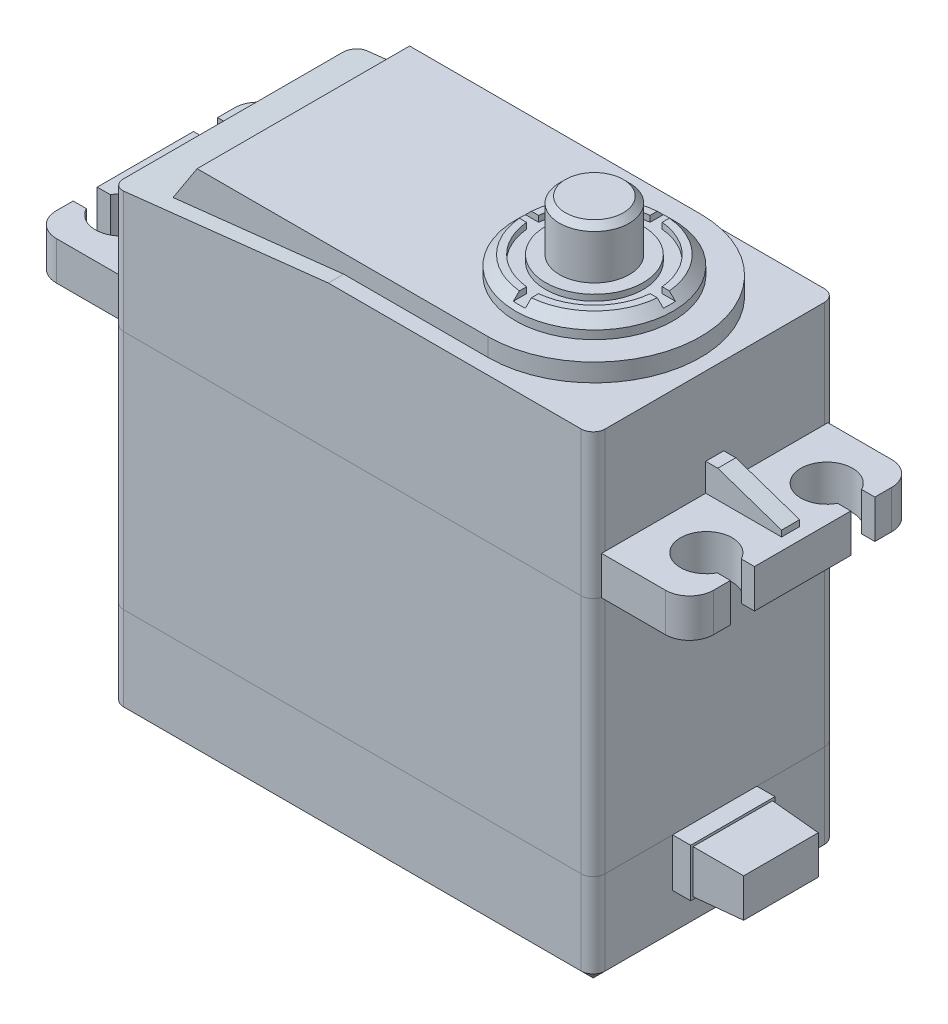
from build123d import *

# Parameters (mm, degrees)
SKETCH1_W                       = 40
SKETCH1_H                       = 20.2
BOSS_EXTRUDE1_DEPTH             = 8
SKETCH3_W                       = 40
SKETCH3_H                       = 20.2
BOSS_EXTRUDE2_DEPTH             = 20
SKETCH4_W                       = 40
SKETCH4_H                       = 20.2
BOSS_EXTRUDE5_DEPTH             = 12
CUT_EXTRUDE1_DEPTH              = 61.066962633
SKETCH6_W                       = 7.3
SKETCH6_H                       = 18.8
BOSS_EXTRUDE6_DEPTH             = 3.2
BOSS_EXTRUDE6_2_DEPTH           = 3.2
CUT_EXTRUDE2_DEPTH              = 61.156213312
BOSS_EXTRUDE7_DEPTH             = 0.75
FILLET1_R                       = 2
FILLET3_R                       = 2
BOSS_EXTRUDE8_DEPTH             = 1.5
BOSS_EXTRUDE8_DIRECTION_2_REACH = 67.156
BOSS_EXTRUDE9_DEPTH             = 17.65
SKETCH11_R                      = 6.55
BOSS_EXTRUDE10_DEPTH            = 1.5
CHAMFER1_SIZE                   = 0.8
SKETCH12_R                      = 4.05
CUT_EXTRUDE3_DEPTH              = 0.5
SKETCH13_R                      = 2.9
BOSS_EXTRUDE11_DEPTH            = 4.2
CHAMFER2_SIZE                   = 0.5
FILLET4_R                       = 1
FILLET5_R                       = 1
FILLET6_R                       = 1
CHAMFER3_SIZE                   = 1
SKETCH14_W                      = 7
SKETCH14_H                      = 4
BOSS_EXTRUDE13_DEPTH            = 1.5


with BuildPart() as part:
    # Sketch1 → Boss-Extrude1 (new body)
    with BuildSketch(Plane(origin=(0, 0, 0), x_dir=(1, 0, 0), z_dir=(0, 1, 0))):
        with Locations((20, 10.1)):
            Rectangle(SKETCH1_W, SKETCH1_H)
    extrude(amount=BOSS_EXTRUDE1_DEPTH)

    # Fillet5
    fillet5_edges = [part.edges().sort_by_distance(p)[0] for p in [
        (0, 4, -20.2),
        (40, 4, -20.2),
        (40, 4, 0),
        (0, 4, 0),
    ]]
    fillet(fillet5_edges, radius=FILLET5_R)

    # Chamfer3
    chamfer3_edges = [part.edges().sort_by_distance(p)[0] for p in [
        (20, 0, 0),
        (0, 0, -10.1),
        (20, 0, -20.2),
        (40, 0, -10.1),
        (39.707106781, 0, -19.907106781),
        (39.707106781, 0, -0.292893219),
        (0.292893219, 0, -19.907106781),
        (0.292893219, 0, -0.292893219),
    ]]
    chamfer(chamfer3_edges, length=CHAMFER3_SIZE)


with BuildPart() as body_2:
    # Sketch3 → Boss-Extrude2 (new body)
    with BuildSketch(Plane(origin=(0, 8, 0), x_dir=(1, 0, 0), z_dir=(0, 1, 0))):
        with Locations((20, 10.1)):
            Rectangle(SKETCH3_W, SKETCH3_H)
    extrude(amount=BOSS_EXTRUDE2_DEPTH)

    # Fillet6
    fillet6_edges = [body_2.edges().sort_by_distance(p)[0] for p in [
        (0, 18, -20.2),
        (40, 18, -20.2),
        (40, 18, 0),
        (0, 18, 0),
    ]]
    fillet(fillet6_edges, radius=FILLET6_R)


with BuildPart() as body_3:
    # Sketch4 → Boss-Extrude5 (new body)
    with BuildSketch(Plane(origin=(0, 28, 0), x_dir=(1, 0, 0), z_dir=(0, 1, 0))):
        with Locations((20, 10.1)):
            Rectangle(SKETCH4_W, SKETCH4_H)
    extrude(amount=BOSS_EXTRUDE5_DEPTH)

    # Sketch5 → Cut-Extrude1 (cut, through all)
    with BuildSketch(Plane.XY):
        Polygon((0, 38), (18, 40), (0, 40), align=None)
    extrude(amount=-CUT_EXTRUDE1_DEPTH, mode=Mode.SUBTRACT)



with BuildPart() as body_4:
    # Sketch6 → Boss-Extrude6 (new body)
    with BuildSketch(Plane(origin=(0, 28, 0), x_dir=(-1, 0, 0), z_dir=(0, -1, 0))):
        with Locations((3.65, 10.1)):
            Rectangle(SKETCH6_W, SKETCH6_H)
    extrude(amount=-BOSS_EXTRUDE6_DEPTH)


with BuildPart() as body_5:
    # Sketch6 → Boss-Extrude6 2 (new body)
    with BuildSketch(Plane(origin=(0, 28, 0), x_dir=(-1, 0, 0), z_dir=(0, -1, 0))):
        with Locations((-43.65, 10.1)):
            Rectangle(SKETCH6_W, SKETCH6_H)
    extrude(amount=-BOSS_EXTRUDE6_2_DEPTH)


with BuildPart() as cut_extrude2_tool:
    # Sketch7 → Cut-Extrude2 (new, through all)
    with BuildSketch(Plane(origin=(0, 31.2, 0), x_dir=(1, 0, 0), z_dir=(0, 1, 0))):
        with BuildLine():
            Line((-6.203286631, 4.1), (-7.3, 4.1))
            Line((-7.3, 4.1), (-7.3, 6.1))
            Line((-7.3, 6.1), (-6.203286631, 6.1))
            ThreePointArc((-6.203286631, 6.1), (-2.15, 5.1), (-6.203286631, 4.1))
        make_face()
        with BuildLine():
            Line((-6.203286631, 14.1), (-7.3, 14.1))
            Line((-7.3, 14.1), (-7.3, 16.1))
            Line((-7.3, 16.1), (-6.203286631, 16.1))
            ThreePointArc((-6.203286631, 16.1), (-2.15, 15.1), (-6.203286631, 14.1))
        make_face()
        with BuildLine():
            Line((46.203286631, 6.1), (47.3, 6.1))
            Line((47.3, 6.1), (47.3, 4.1))
            Line((47.3, 4.1), (46.203286631, 4.1))
            ThreePointArc((46.203286631, 4.1), (42.15, 5.1), (46.203286631, 6.1))
        make_face()
        with BuildLine():
            Line((46.203286631, 16.1), (47.3, 16.1))
            Line((47.3, 16.1), (47.3, 14.1))
            Line((47.3, 14.1), (46.203286631, 14.1))
            ThreePointArc((46.203286631, 14.1), (42.15, 15.1), (46.203286631, 16.1))
        make_face()
    extrude(amount=-CUT_EXTRUDE2_DEPTH)


with BuildPart() as body_4_1:
    add(body_4.part)

    # Cut-Extrude2: cut by cut_extrude2_tool
    add(cut_extrude2_tool.part, mode=Mode.SUBTRACT)


with BuildPart() as body_5_1:
    add(body_5.part)

    # Cut-Extrude2: cut by cut_extrude2_tool
    add(cut_extrude2_tool.part, mode=Mode.SUBTRACT)

    # Fillet3
    fillet3_edges = [body_5_1.edges().sort_by_distance(p)[0] for p in [
        (47.3, 29.6, -19.5),
        (47.3, 29.6, -0.7),
    ]]
    fillet(fillet3_edges, radius=FILLET3_R)


with BuildPart() as body_3_1:
    add(body_3.part)

    add(body_4_1.part)  # Boss-Extrude7 merges body 4
    # Sketch8 → Boss-Extrude7 (add, symmetric)
    with BuildSketch(Plane.XY.offset(-10.1)):
        Polygon((-6.3, 31.2), (0, 31.2), (0, 33.5), (-1, 33.5), (-6.3, 31.7), align=None)
    boss_extrude7 = extrude(amount=BOSS_EXTRUDE7_DEPTH, both=True)

    # Fillet1
    fillet1_edges = [body_3_1.edges().sort_by_distance(p)[0] for p in [
        (-7.3, 29.6, -19.5),
        (-7.3, 29.6, -0.7),
    ]]
    fillet(fillet1_edges, radius=FILLET1_R)

    # Mirror12: Boss-Extrude7 across plane
    add(boss_extrude7.mirror(Plane.ZY.offset(-20)))

    # Sketch9 → Boss-Extrude8 (add)
    with BuildSketch(Plane(origin=(0, 40, 0), x_dir=(1, 0, 0), z_dir=(0, 1, 0))):
        with BuildLine():
            Line((30, 18.925), (5.825, 18.925))
            Line((5.825, 18.925), (5.825, 1.275))
            Line((5.825, 1.275), (30, 1.275))
            ThreePointArc((30, 1.275), (38.825, 10.1), (30, 18.925))
        make_face()
    extrude(amount=BOSS_EXTRUDE8_DEPTH)

    # Sketch9 → Boss-Extrude8 direction 2 (add, up to next)
    with BuildSketch(Plane(origin=(0, 40, 0), x_dir=(1, 0, 0), z_dir=(0, 1, 0)), mode=Mode.PRIVATE) as boss_extrude8_direction_2_sk1:
        with BuildLine():
            Line((30, 18.925), (5.825, 18.925))
            Line((5.825, 18.925), (5.825, 1.275))
            Line((5.825, 1.275), (30, 1.275))
            ThreePointArc((30, 1.275), (38.825, 10.1), (30, 18.925))
        make_face()
    boss_extrude8_direction_2_tool1 = extrude(boss_extrude8_direction_2_sk1.sketch, amount=-BOSS_EXTRUDE8_DIRECTION_2_REACH, mode=Mode.PRIVATE) - body_3_1.part
    add(boss_extrude8_direction_2_tool1.solids().sort_by_distance((21.440432, 40, -10.1))[0])

    # Sketch10 → Boss-Extrude9 (add)
    with BuildSketch(Plane.XY.offset(-1.275)):
        Polygon((5.825, 41.5), (3.825, 38.425), (5.825, 38.647222222), align=None)
    extrude(amount=-BOSS_EXTRUDE9_DEPTH)

    # Sketch11 → Boss-Extrude10 (add)
    with BuildSketch(Plane(origin=(0, 41.5, 0), x_dir=(1, 0, 0), z_dir=(0, 1, 0))):
        with Locations(Location((30, 10.1, 0), (0, 0, 270))):
            Circle(SKETCH11_R)
    extrude(amount=BOSS_EXTRUDE10_DEPTH)

    # Chamfer1
    chamfer1_edges = [body_3_1.edges().sort_by_distance(p)[0] for p in [
        (30, 43, -16.65),
    ]]
    chamfer(chamfer1_edges, length=CHAMFER1_SIZE)

    # Sketch12 → Cut-Extrude3 (cut)
    with BuildSketch(Plane(origin=(0, 43, 0), x_dir=(1, 0, 0), z_dir=(0, 1, 0))):
        with BuildLine():
            Line((29.5, 15.233183841), (29.5, 16.630888148))
            ThreePointArc((29.5, 16.630888148), (30, 16.65), (30.5, 16.630888148))
            Line((30.5, 16.630888148), (30.5, 15.233183841))
            ThreePointArc((30.5, 15.233183841), (33.646887464, 13.746887464), (35.133183841, 10.6))
            Line((35.133183841, 10.6), (36.530888148, 10.6))
            ThreePointArc((36.530888148, 10.6), (36.55, 10.1), (36.530888148, 9.6))
            Line((36.530888148, 9.6), (35.133183841, 9.6))
            ThreePointArc((35.133183841, 9.6), (33.646887464, 6.453112536), (30.5, 4.966816159))
            Line((30.5, 4.966816159), (30.5, 3.569111852))
            ThreePointArc((30.5, 3.569111852), (30, 3.55), (29.5, 3.569111852))
            Line((29.5, 3.569111852), (29.5, 4.966816159))
            ThreePointArc((29.5, 4.966816159), (26.353112536, 6.453112536), (24.866816159, 9.6))
            Line((24.866816159, 9.6), (23.469111852, 9.6))
            ThreePointArc((23.469111852, 9.6), (23.45, 10.1), (23.469111852, 10.6))
            Line((23.469111852, 10.6), (24.866816159, 10.6))
            ThreePointArc((24.866816159, 10.6), (26.353112536, 13.746887464), (29.5, 15.233183841))
        make_face()
        with Locations(Location((30, 10.1, 0), (0, 0, 270))):
            Circle(SKETCH12_R, mode=Mode.SUBTRACT)
    extrude(amount=-CUT_EXTRUDE3_DEPTH, mode=Mode.SUBTRACT)

    # Sketch13 → Boss-Extrude11 (add)
    with BuildSketch(Plane(origin=(0, 43, 0), x_dir=(1, 0, 0), z_dir=(0, 1, 0))):
        with Locations(Location((30, 10.1, 0), (0, 0, 270))):
            Circle(SKETCH13_R)
    extrude(amount=BOSS_EXTRUDE11_DEPTH)

    # Chamfer2
    chamfer2_edges = [body_3_1.edges().sort_by_distance(p)[0] for p in [
        (30, 47.2, -13),
    ]]
    chamfer(chamfer2_edges, length=CHAMFER2_SIZE)

    # Fillet4
    fillet4_edges = [body_3_1.edges().sort_by_distance(p)[0] for p in [
        (0, 33, -20.2),
        (40, 34, -20.2),
        (40, 34, 0),
        (0, 33, 0),
    ]]
    fillet(fillet4_edges, radius=FILLET4_R)


with BuildPart() as body_5_2:
    # Sketch14 → Boss-Extrude13 (new body)
    with BuildSketch(Plane(origin=(40, 0, 0), x_dir=(0, 0, -1), z_dir=(1, 0, 0))):
        with Locations((10.1, 6)):
            Rectangle(SKETCH14_W, SKETCH14_H)
    extrude(amount=BOSS_EXTRUDE13_DEPTH)

    # Sketch15 → Loft1 section 0
    with BuildSketch(Plane(origin=(41.5, 0, 0), x_dir=(0, 0, -1), z_dir=(1, 0, 0))):
        with BuildLine():
            Line((6.8, 7.8), (6.8, 4.2))
            Line((6.8, 4.2), (13.4, 4.2))
            Line((13.4, 4.2), (13.4, 7.8))
            Line((13.4, 7.8), (6.8, 7.8))
        make_face()
    # Sketch16 → Loft1 section 1
    with BuildSketch(Plane(origin=(45.5, 0, 0), x_dir=(0, 0, -1), z_dir=(1, 0, 0))):
        with BuildLine():
            Line((7, 7.6), (7, 4.4))
            Line((7, 4.4), (13.2, 4.4))
            Line((13.2, 4.4), (13.2, 7.6))
            Line((13.2, 7.6), (7, 7.6))
        make_face()
    loft()


solid = Compound([part.part, body_2.part, body_5_1.part, body_3_1.part, body_5_2.part])
